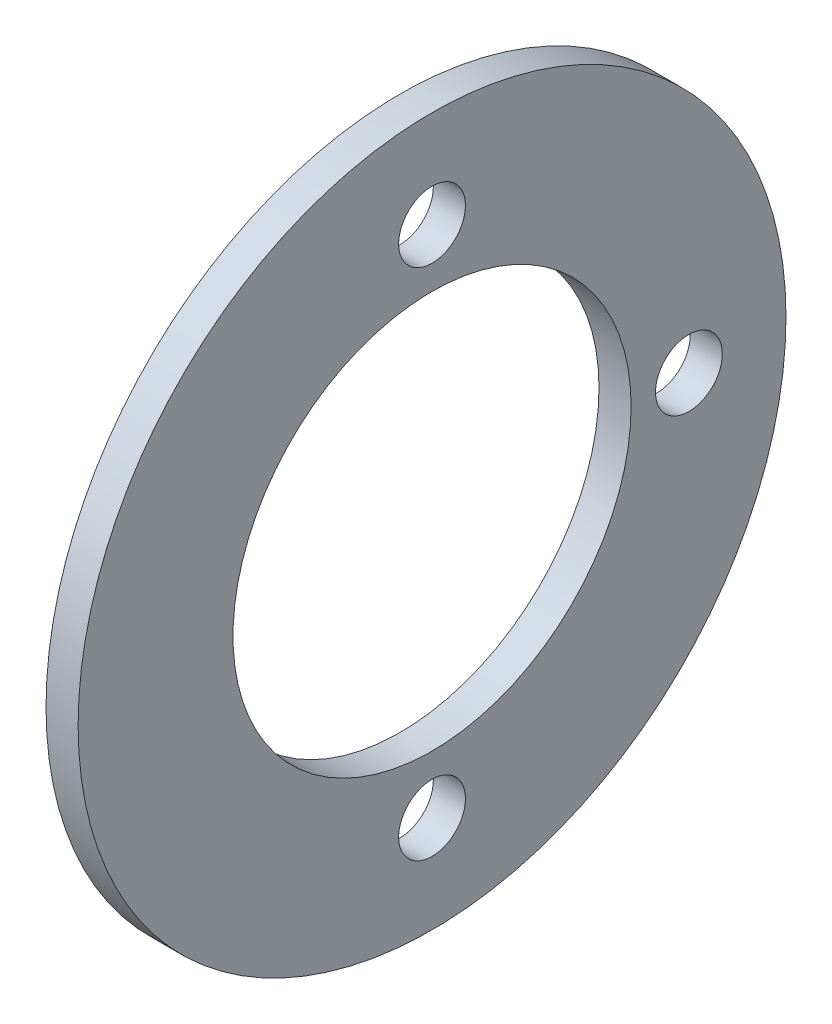
from build123d import *

# Parameters (mm, degrees)
SKETCH1_R           = 35
SKETCH1_R_2         = 19.685
SKETCH1_R_3         = 3.302
BOSS_EXTRUDE1_DEPTH = 3.175


with BuildPart() as part:
    # Sketch1 → Boss-Extrude1 (new body)
    with BuildSketch(Plane(origin=(0, 0, 0), x_dir=(0, 0, -1), z_dir=(1, 0, 0))):
        Circle(SKETCH1_R)
        Circle(SKETCH1_R_2, mode=Mode.SUBTRACT)
        with Locations((0, 25.4)):
            Circle(SKETCH1_R_3, mode=Mode.SUBTRACT)
        with Locations((25.4, 0)):
            Circle(SKETCH1_R_3, mode=Mode.SUBTRACT)
        with Locations((0, -25.4)):
            Circle(SKETCH1_R_3, mode=Mode.SUBTRACT)
    extrude(amount=BOSS_EXTRUDE1_DEPTH)


solid = part.part
